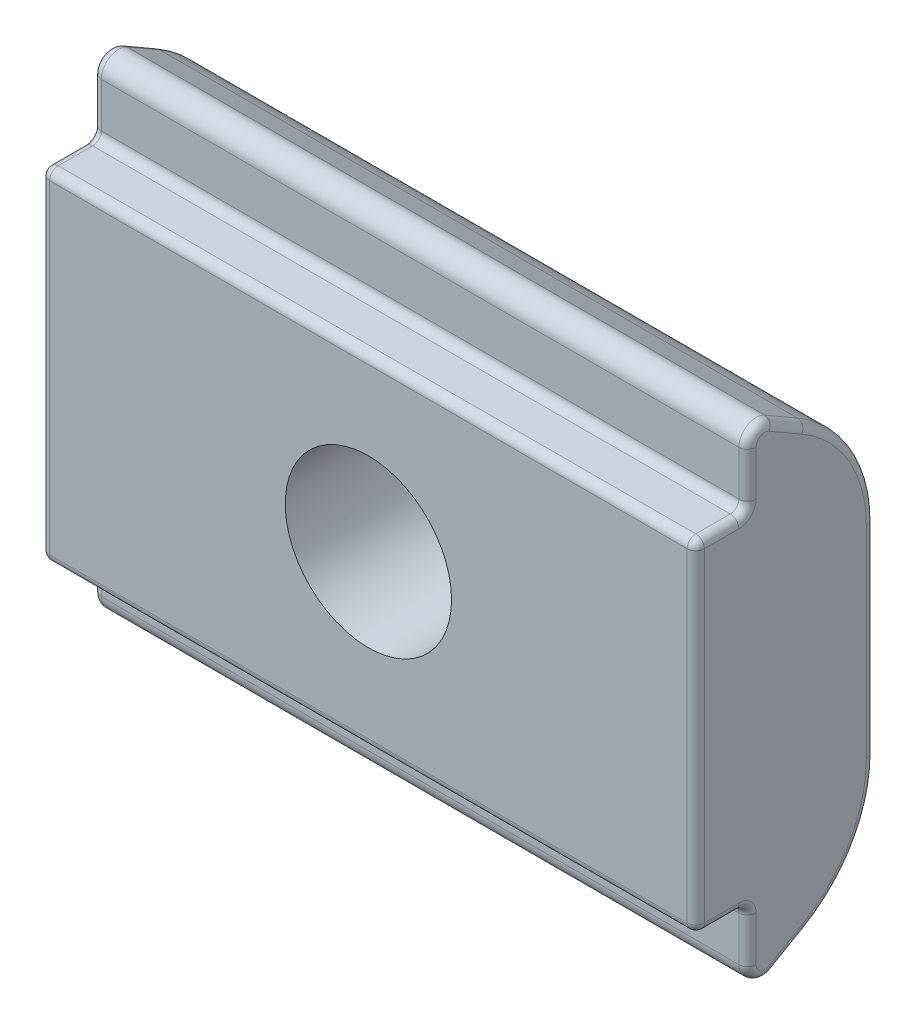
from build123d import *

# Parameters (mm, degrees)
BOSS_EXTRUDE1_DEPTH      = 9.5
BOSS_EXTRUDE1_DEPTH_BACK = 9.5
SKETCH6_R                = 2.413
CUT_EXTRUDE2_DEPTH       = 13.895347998
FILLET5_R                = 0.25


with BuildPart() as part:
    # Sketch4 → Boss-Extrude1 (new, two sides: drawn at the far end of the back side and taken through both)
    with BuildSketch(Plane(origin=(0, 0, 0), x_dir=(0, 0, -1), z_dir=(1, 0, 0)).offset(-BOSS_EXTRUDE1_DEPTH_BACK)):
        with BuildLine():
            Line((-0.35, 6.933012702), (0.6, 6.384529946))
            ThreePointArc((0.6, 6.384529946), (2.064101615, 4.920428331), (2.6, 2.920428331))
            Line((2.6, 2.920428331), (2.6, -2.920428331))
            ThreePointArc((2.6, -2.920428331), (2.064101615, -4.920428331), (0.6, -6.384529946))
            Line((0.6, -6.384529946), (-0.35, -6.933012702))
            ThreePointArc((-0.35, -6.933012702), (-0.85, -6.933012702), (-1.1, -6.5))
            Line((-1.1, -6.5), (-1.1, -4.95))
            Line((-1.1, -4.95), (-2.6, -4.95))
            Line((-2.6, -4.95), (-2.6, 4.95))
            Line((-2.6, 4.95), (-1.1, 4.95))
            Line((-1.1, 4.95), (-1.1, 6.5))
            ThreePointArc((-1.1, 6.5), (-0.85, 6.933012702), (-0.35, 6.933012702))
        make_face()
    extrude(amount=BOSS_EXTRUDE1_DEPTH + BOSS_EXTRUDE1_DEPTH_BACK)

    # Sketch6 → Cut-Extrude2 (cut, through all)
    with BuildSketch(Plane.XY.offset(2.6)):
        Circle(SKETCH6_R)
    extrude(amount=-CUT_EXTRUDE2_DEPTH, mode=Mode.SUBTRACT)

    # Fillet5
    fillet5_edges = [part.edges().sort_by_distance(p)[0] for p in [
        (-9.5, 4.920428331, -2.064101615),
        (-9.5, 6.658771324, -0.125),
        (-9.5, 6.933012702, 0.85),
        (-9.5, 5.725, 1.1),
        (0, -4.95, 1.1),
        (0, -4.95, 2.6),
        (0, 4.95, 2.6),
        (0, 4.95, 1.1),
        (-9.5, 4.95, 1.85),
        (-9.5, 0, 2.6),
        (-9.5, -4.95, 1.85),
        (-9.5, -5.725, 1.1),
        (9.5, -4.920428331, -2.064101615),
        (9.5, 0, -2.6),
        (9.5, 4.920428331, -2.064101615),
        (-9.5, -6.933012702, 0.85),
        (9.5, 6.658771324, -0.125),
        (9.5, 6.933012702, 0.85),
        (9.5, 5.725, 1.1),
        (9.5, 4.95, 1.85),
        (9.5, 0, 2.6),
        (9.5, -4.95, 1.85),
        (9.5, -5.725, 1.1),
        (9.5, -6.933012702, 0.85),
        (9.5, -6.658771324, -0.125),
        (-9.5, -6.658771324, -0.125),
        (-9.5, -4.920428331, -2.064101615),
        (-9.5, 0, -2.6),
    ]]
    fillet(fillet5_edges, radius=FILLET5_R)


solid = part.part
